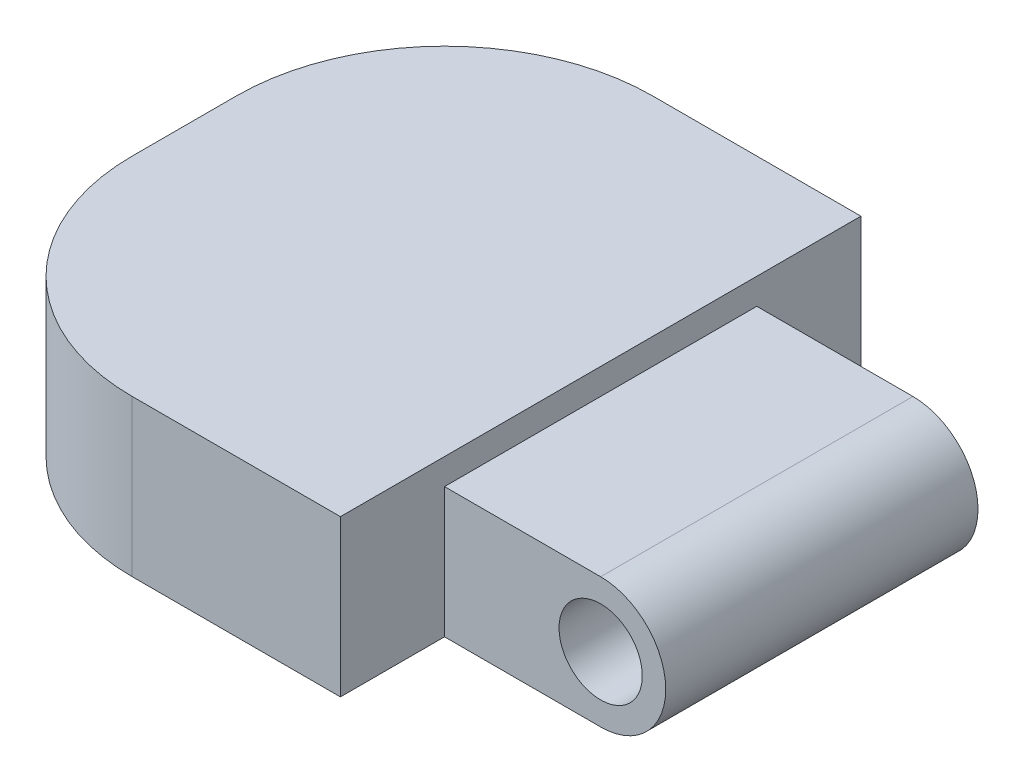
from build123d import *

# Parameters (mm, degrees)
BOSS_EXTRUDE1_DEPTH      = 38.1
BOSS_EXTRUDE2_DEPTH      = 38.1
BOSS_EXTRUDE2_DEPTH_BACK = 38.1
SKETCH3_R                = 10.16
CUT_EXTRUDE1_DEPTH       = 151.837563707


with BuildPart() as part:
    # Sketch1 → Boss-Extrude1 (new body)
    with BuildSketch(Plane(origin=(0, 0, 0), x_dir=(1, 0, 0), z_dir=(0, 1, 0))):
        with BuildLine():
            Line((50.8, 63.5), (0, 63.5))
            ThreePointArc((0, 63.5), (-35.921024484, 48.621024484), (-50.8, 12.7))
            Line((-50.8, 12.7), (-50.8, -12.7))
            ThreePointArc((-50.8, -12.7), (-35.921024484, -48.621024484), (0, -63.5))
            Line((0, -63.5), (50.8, -63.5))
            Line((50.8, -63.5), (50.8, 63.5))
        make_face()
    extrude(amount=BOSS_EXTRUDE1_DEPTH)

    # Sketch2 → Boss-Extrude2 (add, two sides: drawn at the far end of the back side and taken through both)
    with BuildSketch(Plane.XY.offset(-BOSS_EXTRUDE2_DEPTH_BACK)):
        with BuildLine():
            Line((50.8, 31.75), (88.9, 31.75))
            ThreePointArc((88.9, 31.75), (104.775, 15.875), (88.9, 0))
            Line((88.9, 0), (50.8, 0))
            Line((50.8, 0), (50.8, 31.75))
        make_face()
    extrude(amount=BOSS_EXTRUDE2_DEPTH + BOSS_EXTRUDE2_DEPTH_BACK)

    # Sketch3 → Cut-Extrude1 (cut, through all)
    with BuildSketch(Plane(origin=(0, 0, -38.1), x_dir=(-1, 0, 0), z_dir=(0, 0, -1))):
        with Locations((-88.9, 15.875)):
            Circle(SKETCH3_R)
    extrude(amount=-CUT_EXTRUDE1_DEPTH, mode=Mode.SUBTRACT)


solid = part.part
